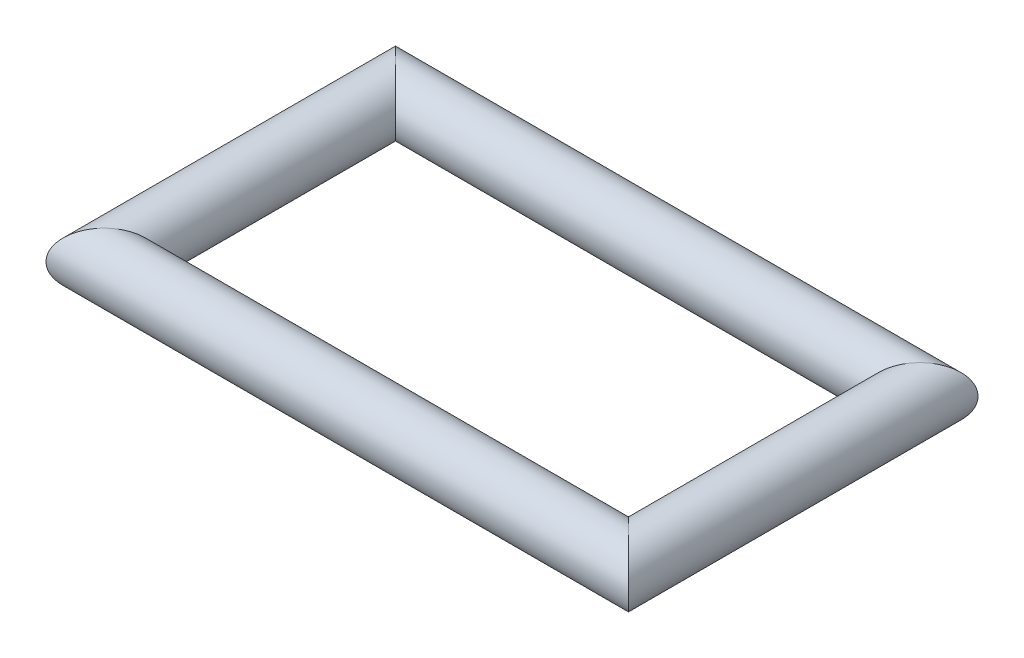
from build123d import *

# Parameters (mm, degrees)
BARRER3_PROFILE_R = 5


with BuildPart() as part:
    # Barrer3: sweep along a path in Croquis2
    with BuildLine(Plane(origin=(0, 0, 0), x_dir=(1, 0, 0), z_dir=(0, 1, 0))) as barrer3_path:
        Line((0, -25), (90, -25))
        Line((90, -25), (90, 25))
        Line((90, 25), (0, 25))
        Line((0, 25), (0, -25))
    # Barrer3 profile (on start of the path) → Barrer3 (sweep)
    with BuildSketch(Plane(origin=(0, 0, 25), x_dir=(0, 0, 1), z_dir=(1, 0, 0))):
        Circle(BARRER3_PROFILE_R)
    sweep(path=barrer3_path.line, transition=Transition.RIGHT)


solid = part.part
